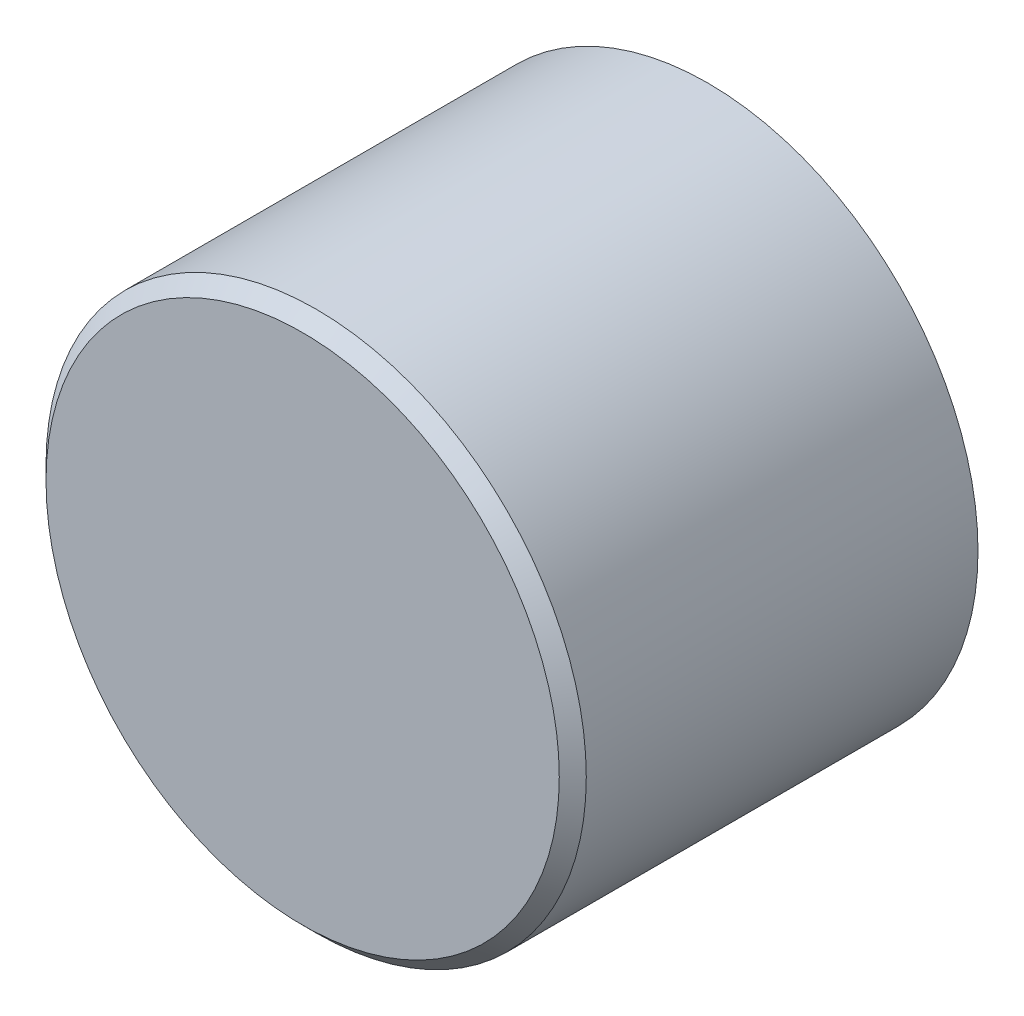
from build123d import *

# Parameters (mm, degrees)
COMPONENT_OUTLINE_R = 2
EXTRUDE1_DEPTH      = 3
CHAMFER1_SIZE       = 0.1


with BuildPart() as part:
    # COMPONENT_OUTLINE → Extrude1 (new body)
    with BuildSketch(Plane.XY):
        Circle(COMPONENT_OUTLINE_R)
    extrude(amount=EXTRUDE1_DEPTH)

    # Chamfer1
    chamfer1_edges = [part.edges().sort_by_distance(p)[0] for p in [
        (-2, 0, 3),
    ]]
    chamfer(chamfer1_edges, length=CHAMFER1_SIZE)


solid = part.part
